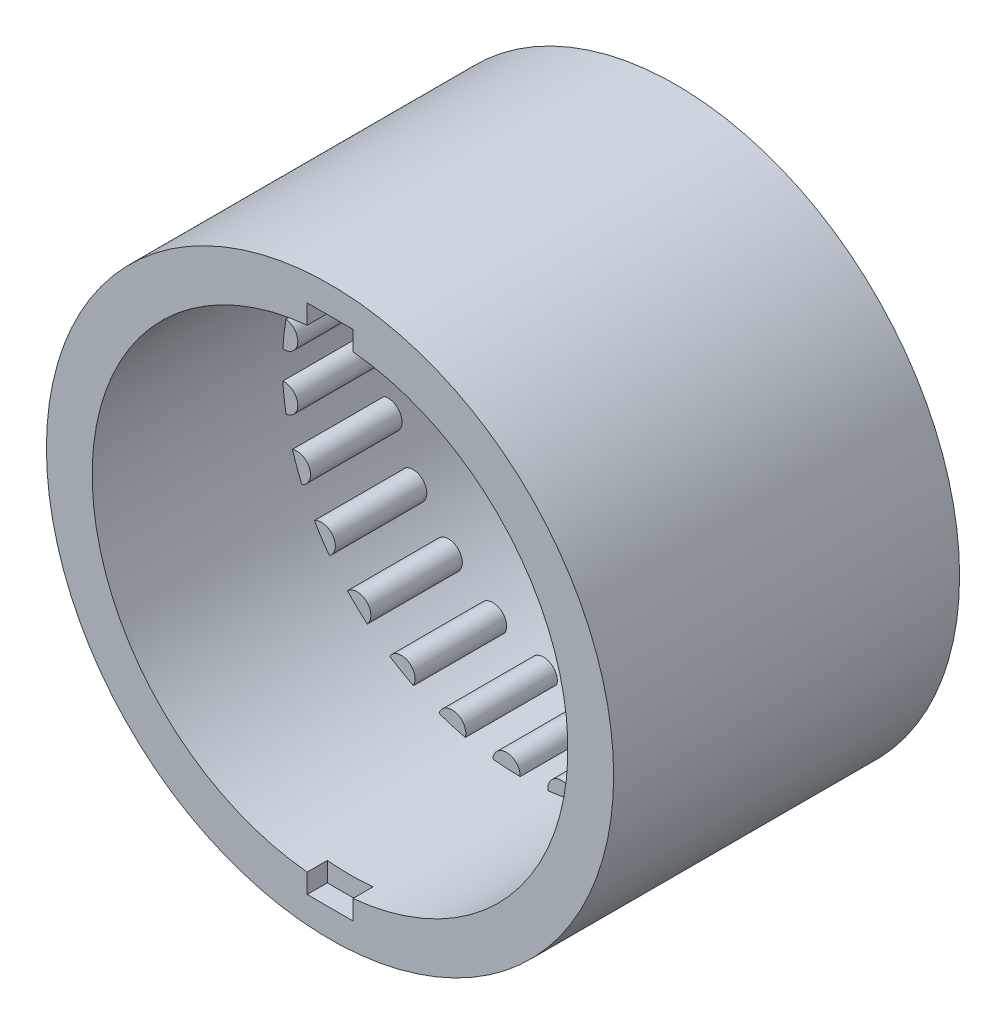
from build123d import *

# Parameters (mm, degrees)
SKETCH3_R                       = 31
SKETCH3_R_2                     = 26
BOSS_EXTRUDE1_DEPTH             = 7.0104
SKETCH4_R                       = 31
SKETCH4_R_2                     = 26
BOSS_EXTRUDE2_DEPTH             = 10
SKETCH5_R                       = 1.5
BOSS_EXTRUDE3_DEPTH             = 10
SKETCH7_R                       = 31
SKETCH7_R_2                     = 26
BOSS_EXTRUDE4_DEPTH             = 13
BOSS_EXTRUDE5_DEPTH             = 36
BOSS_EXTRUDE5_DEPTH_BACK        = 36
SKETCH9_R                       = 31
SKETCH9_R_2                     = 26.2
BOSS_EXTRUDE9_REACH             = 82.511
SKETCH34_R                      = 31
SKETCH34_R_2                    = 26
SKETCH35_R                      = 26.2
BOSS_EXTRUDE10_DEPTH            = 6
SKETCH37_R                      = 2.3
CUT_EXTRUDE1_DEPTH              = 6
SKETCH39_R                      = 11.1
CUT_EXTRUDE2_DEPTH              = 2.1
SKETCH41_R                      = 5
CUT_EXTRUDE3_DEPTH              = 4
SKETCH45_R                      = 26
CUT_EXTRUDE6_DEPTH              = 31
SKETCH47_R                      = 1.7
CUT_EXTRUDE7_DEPTH              = 118.903636822
CIRPATTERN1_COUNT               = 4
SKETCH48_W                      = 5
SKETCH48_H                      = 56
CUT_EXTRUDE10_DEPTH             = 28.4
CUT_EXTRUDE11_DEPTH             = 80.714061918
CUT_EXTRUDE12_REACH             = 106.121
CUT_EXTRUDE12_DIRECTION_2_DEPTH = 105.121407837
SKETCH54_W                      = 16.469339318
SKETCH54_H                      = 18
CUT_EXTRUDE13_DEPTH             = 105.121407837
CUT_EXTRUDE14_DEPTH             = 1.2
CUT_EXTRUDE14_DEPTH_BACK        = 74.437050306
SKETCH55_W                      = 62
SKETCH55_H                      = 72
CUT_EXTRUDE15_DEPTH             = 62.472036971


with BuildPart() as part:
    # Sketch3 → Boss-Extrude1 (new body)
    with BuildSketch(Plane.XY.offset(-2.359079422)):
        Circle(SKETCH3_R)
        Circle(SKETCH3_R_2, mode=Mode.SUBTRACT)
    extrude(amount=BOSS_EXTRUDE1_DEPTH)

    # Sketch4 → Boss-Extrude2 (add)
    with BuildSketch(Plane.XY.offset(4.651320578)):
        Circle(SKETCH4_R)
        Circle(SKETCH4_R_2, mode=Mode.SUBTRACT)
    extrude(amount=BOSS_EXTRUDE2_DEPTH)

    # Sketch5 → Boss-Extrude3 (add)
    with BuildSketch(Plane.XY.offset(4.651320578)):
        with Locations((26, 0)):
            Circle(SKETCH5_R)
        with Locations((25.299166635, -5.996012639)):
            Circle(SKETCH5_R)
        with Locations((23.234448648, -11.668778685)):
            Circle(SKETCH5_R)
        with Locations((19.917155521, -16.712477852)):
            Circle(SKETCH5_R)
        with Locations((15.526123384, -20.855203012)):
            Circle(SKETCH5_R)
        with Locations((10.298073917, -23.873618779)):
            Circle(SKETCH5_R)
        with Locations((4.514852619, -25.605001578)):
            Circle(SKETCH5_R)
        with Locations((-1.511765552, -25.956012115)):
            Circle(SKETCH5_R)
        with Locations((-7.45688405, -24.90772732)):
            Circle(SKETCH5_R)
        with Locations((-13, -22.516660498)):
            Circle(SKETCH5_R)
        with Locations((-17.842282585, -18.911714681)):
            Circle(SKETCH5_R)
        with Locations((-21.722683097, -14.28723343)):
            Circle(SKETCH5_R)
        with Locations((-24.43200814, -8.892523726)):
            Circle(SKETCH5_R)
        with Locations((-25.824197301, -3.018415767)):
            Circle(SKETCH5_R)
        with Locations((-25.824197301, 3.018415767)):
            Circle(SKETCH5_R)
        with Locations((-24.43200814, 8.892523726)):
            Circle(SKETCH5_R)
        with Locations((-21.722683097, 14.28723343)):
            Circle(SKETCH5_R)
        with Locations((-17.842282585, 18.911714681)):
            Circle(SKETCH5_R)
        with Locations((-13, 22.516660498)):
            Circle(SKETCH5_R)
        with Locations((-7.45688405, 24.90772732)):
            Circle(SKETCH5_R)
        with Locations((-1.511765552, 25.956012115)):
            Circle(SKETCH5_R)
        with Locations((4.514852619, 25.605001578)):
            Circle(SKETCH5_R)
        with Locations((10.298073917, 23.873618779)):
            Circle(SKETCH5_R)
        with Locations((15.526123384, 20.855203012)):
            Circle(SKETCH5_R)
        with Locations((19.917155521, 16.712477852)):
            Circle(SKETCH5_R)
        with Locations((23.234448648, 11.668778685)):
            Circle(SKETCH5_R)
        with Locations((25.299166635, 5.996012639)):
            Circle(SKETCH5_R)
    extrude(amount=BOSS_EXTRUDE3_DEPTH)

    # Sketch7 → Boss-Extrude4 (add)
    with BuildSketch(Plane.XY.offset(14.651320578)):
        Circle(SKETCH7_R)
        Circle(SKETCH7_R_2, mode=Mode.SUBTRACT)
    extrude(amount=BOSS_EXTRUDE4_DEPTH)


with BuildPart() as body_2:
    # Sketch9 → Boss-Extrude5 (new, two sides: drawn at the far end of the back side and taken through both)
    with BuildSketch(Plane(origin=(0, 0, 0), x_dir=(1, 0, 0), z_dir=(0, 1, 0)).offset(-BOSS_EXTRUDE5_DEPTH_BACK)):
        with Locations(Location((0, -61.651320578, 0), (0, 0, 270))):
            Circle(SKETCH9_R)
        with Locations(Location((0, -61.651320578, 0), (0, 0, 270))):
            Circle(SKETCH9_R_2, mode=Mode.SUBTRACT)
    extrude(amount=BOSS_EXTRUDE5_DEPTH + BOSS_EXTRUDE5_DEPTH_BACK)

    # Sketch34 → Boss-Extrude9 (add, up to next)
    with BuildSketch(Plane.XY.offset(27.651320578), mode=Mode.PRIVATE) as boss_extrude9_sk1:
        Circle(SKETCH34_R)
        with Locations(Location((0, 0, 0), (0, 0, 180))):
            Circle(SKETCH34_R_2, mode=Mode.SUBTRACT)
    boss_extrude9_tool1 = extrude(boss_extrude9_sk1.sketch, amount=BOSS_EXTRUDE9_REACH, mode=Mode.PRIVATE) - body_2.part

    add(part.part)  # Boss-Extrude9 merges part
    add(boss_extrude9_tool1.solids().sort_by_distance((-30.123188, 0, 27.651321))[0])

    # Sketch35 → Boss-Extrude10 (add)
    with BuildSketch(Plane.XZ.offset(36)):
        with Locations(Location((0, 61.651320578, 0), (0, 0, 90))):
            Circle(SKETCH35_R)
    extrude(amount=-BOSS_EXTRUDE10_DEPTH)

    # Sketch37 → Cut-Extrude1 (cut)
    with BuildSketch(Plane(origin=(0, -30, 0), x_dir=(1, 0, 0), z_dir=(0, 1, 0))):
        with Locations(Location((0, -77.651320578, 0), (0, 0, 270))):
            Circle(SKETCH37_R)
        with Locations(Location((-13.856406461, -69.651320578, 0), (0, 0, 270))):
            Circle(SKETCH37_R)
        with Locations(Location((-13.856406461, -53.651320578, 0), (0, 0, 270))):
            Circle(SKETCH37_R)
        with Locations(Location((0, -45.651320578, 0), (0, 0, 270))):
            Circle(SKETCH37_R)
        with Locations(Location((13.856406461, -53.651320578, 0), (0, 0, 270))):
            Circle(SKETCH37_R)
        with Locations(Location((13.856406461, -69.651320578, 0), (0, 0, 270))):
            Circle(SKETCH37_R)
    extrude(amount=-CUT_EXTRUDE1_DEPTH, mode=Mode.SUBTRACT)

    # Sketch39 → Cut-Extrude2 (cut)
    with BuildSketch(Plane(origin=(0, -30, 0), x_dir=(1, 0, 0), z_dir=(0, 1, 0))):
        with Locations(Location((0, -61.651320578, 0), (0, 0, 270))):
            Circle(SKETCH39_R)
    extrude(amount=-CUT_EXTRUDE2_DEPTH, mode=Mode.SUBTRACT)

    # Sketch41 → Cut-Extrude3 (cut)
    with BuildSketch(Plane(origin=(0, -32.1, 0), x_dir=(1, 0, 0), z_dir=(0, 1, 0))):
        with Locations(Location((0, -61.651320578, 0), (0, 0, 270))):
            Circle(SKETCH41_R)
    extrude(amount=-CUT_EXTRUDE3_DEPTH, mode=Mode.SUBTRACT)

    # Sketch45 → Cut-Extrude6 (cut)
    with BuildSketch(Plane(origin=(0, 0, 61.651320578), x_dir=(-1, 0, 0), z_dir=(0, 0, -1))):
        with Locations(Location((0, 0, 0), (0, 0, 180))):
            Circle(SKETCH45_R)
    extrude(amount=CUT_EXTRUDE6_DEPTH, mode=Mode.SUBTRACT)

    # Sketch47 → Cut-Extrude7 (cut, through all)
    with BuildSketch(Plane(origin=(0, -30, 0), x_dir=(1, 0, 0), z_dir=(0, 1, 0))):
        with Locations(Location((-15.5, -77.15132, 0), (0, 0, 270))):
            Circle(SKETCH47_R)
        with Locations(Location((-15.499999422, -46.151320578, 0), (0, 0, 270))):
            Circle(SKETCH47_R)
        with Locations(Location((15.5, -46.151321156, 0), (0, 0, 270))):
            Circle(SKETCH47_R)
        with Locations(Location((15.499999422, -77.151320578, 0), (0, 0, 270))):
            Circle(SKETCH47_R)
    extrude(amount=-CUT_EXTRUDE7_DEPTH, mode=Mode.SUBTRACT)

    # Sketch43 → Cut-Revolve1 (revolve, cut)
    with BuildSketch(Plane(origin=(-8.335079128, 0, 77.151320134), x_dir=(0.9999999999999999, 0, 1.8652727112514236e-08), z_dir=(-1.8652727112514233e-08, 0, 0.9999999999999998)), mode=Mode.PRIVATE) as cut_revolve1_sk:
        Polygon((20.835078549, -36), (22.135079128, -36), (22.135079128, -33.115), (20.835078549, -34.415), align=None)
    cut_revolve1 = revolve(cut_revolve1_sk.sketch.rotate(Axis((15.499999422, -36, 77.151320578), (0, 1, 0)), 180.000001069), axis=Axis((15.499999422, -36, 77.151320578), (0, 1, 0)), mode=Mode.SUBTRACT)

    # CirPattern1: Cut-Revolve1 ×4 about axis
    cirpattern1_axis = Axis((0, 0, 61.651320578), (0, 1, 0))
    for i in range(1, CIRPATTERN1_COUNT):
        add(cut_revolve1.rotate(cirpattern1_axis, i * 360 / CIRPATTERN1_COUNT), mode=Mode.SUBTRACT)

    # Sketch48 → Cut-Extrude10 (cut)
    with BuildSketch(Plane(origin=(0, 0, 61.651320578), x_dir=(-1, 0, 0), z_dir=(0, 0, -1))):
        Rectangle(SKETCH48_W, SKETCH48_H)
    extrude(amount=CUT_EXTRUDE10_DEPTH, mode=Mode.SUBTRACT)

    # Sketch49 → Cut-Extrude11 (cut, through all)
    with BuildSketch(Plane(origin=(0, 0, 61.651320578), x_dir=(-1, 0, 0), z_dir=(0, 0, -1))):
        with BuildLine():
            Line((-7.5, 17.5), (7.5, 17.5))
            ThreePointArc((7.5, 17.5), (9.267766953, 16.767766953), (10, 15))
            Line((10, 15), (10, -15))
            ThreePointArc((10, -15), (9.267766953, -16.767766953), (7.5, -17.5))
            Line((7.5, -17.5), (-7.5, -17.5))
            ThreePointArc((-7.5, -17.5), (-9.267766953, -16.767766953), (-10, -15))
            Line((-10, -15), (-10, 15))
            ThreePointArc((-10, 15), (-9.267766953, 16.767766953), (-7.5, 17.5))
        make_face()
    extrude(amount=-CUT_EXTRUDE11_DEPTH, mode=Mode.SUBTRACT)

    # Cut-Extrude12: up to this face of the body (flat: up to its plane)
    cut_extrude12_end = Plane(body_2.part.faces().sort_by_distance((0, -30, 36.192368485))[0])
    # Sketch51 → Cut-Extrude12 (cut, up to the picked face)
    with BuildSketch(Plane(origin=(0, 0, 0), x_dir=(1, 0, 0), z_dir=(0, 1, 0)), mode=Mode.PRIVATE) as cut_extrude12_sk1:
        with BuildLine():
            Line((-14.238968268, -82.857120578), (-16.748327145, -82.857120578))
            ThreePointArc((-16.748327145, -82.857120578), (-17.134760875, -82.78025413), (-17.462363572, -82.561357006))
            Line((-17.462363572, -82.561357006), (-20.910036428, -79.113684151))
            ThreePointArc((-20.910036428, -79.113684151), (-21.128933552, -78.786081453), (-21.2058, -78.399647723))
            Line((-21.2058, -78.399647723), (-21.2058, -75.890288846))
            Line((-21.2058, -75.890288846), (-21.2058, -47.41235231))
            Line((-21.2058, -47.41235231), (-21.2058, -44.902993434))
            ThreePointArc((-21.2058, -44.902993434), (-21.128933552, -44.516559704), (-20.910036428, -44.188957006))
            Line((-20.910036428, -44.188957006), (-17.462363572, -40.741284151))
            ThreePointArc((-17.462363572, -40.741284151), (-17.134760875, -40.522387026), (-16.748327145, -40.445520578))
            Line((-16.748327145, -40.445520578), (-14.238968268, -40.445520578))
            Line((-14.238968268, -40.445520578), (14.238968268, -40.445520578))
            Line((14.238968268, -40.445520578), (16.748327145, -40.445520578))
            ThreePointArc((16.748327145, -40.445520578), (17.134760875, -40.522387026), (17.462363572, -40.741284151))
            Line((17.462363572, -40.741284151), (20.910036428, -44.188957006))
            ThreePointArc((20.910036428, -44.188957006), (21.128933552, -44.516559704), (21.2058, -44.902993434))
            Line((21.2058, -44.902993434), (21.2058, -47.41235231))
            Line((21.2058, -47.41235231), (21.2058, -75.890288846))
            Line((21.2058, -75.890288846), (21.2058, -78.399647723))
            ThreePointArc((21.2058, -78.399647723), (21.128933552, -78.786081453), (20.910036428, -79.113684151))
            Line((20.910036428, -79.113684151), (17.462363572, -82.561357006))
            ThreePointArc((17.462363572, -82.561357006), (17.134760875, -82.78025413), (16.748327145, -82.857120578))
            Line((16.748327145, -82.857120578), (14.238968268, -82.857120578))
            Line((14.238968268, -82.857120578), (-14.238968268, -82.857120578))
        make_face()
    cut_extrude12_tool1 = split(extrude(cut_extrude12_sk1.sketch, amount=-CUT_EXTRUDE12_REACH, mode=Mode.PRIVATE), bisect_by=cut_extrude12_end, keep=Keep.BOTH, mode=Mode.PRIVATE)
    add(cut_extrude12_tool1.solids().sort_by(Axis((0, 0, 61.651321), (0, -1, 0)))[0], mode=Mode.SUBTRACT)

    # Sketch51 → Cut-Extrude12 direction 2 (cut)
    with BuildSketch(Plane(origin=(0, 0, 0), x_dir=(1, 0, 0), z_dir=(0, 1, 0))):
        with BuildLine():
            Line((-14.238968268, -82.857120578), (-16.748327145, -82.857120578))
            ThreePointArc((-16.748327145, -82.857120578), (-17.134760875, -82.78025413), (-17.462363572, -82.561357006))
            Line((-17.462363572, -82.561357006), (-20.910036428, -79.113684151))
            ThreePointArc((-20.910036428, -79.113684151), (-21.128933552, -78.786081453), (-21.2058, -78.399647723))
            Line((-21.2058, -78.399647723), (-21.2058, -75.890288846))
            Line((-21.2058, -75.890288846), (-21.2058, -47.41235231))
            Line((-21.2058, -47.41235231), (-21.2058, -44.902993434))
            ThreePointArc((-21.2058, -44.902993434), (-21.128933552, -44.516559704), (-20.910036428, -44.188957006))
            Line((-20.910036428, -44.188957006), (-17.462363572, -40.741284151))
            ThreePointArc((-17.462363572, -40.741284151), (-17.134760875, -40.522387026), (-16.748327145, -40.445520578))
            Line((-16.748327145, -40.445520578), (-14.238968268, -40.445520578))
            Line((-14.238968268, -40.445520578), (14.238968268, -40.445520578))
            Line((14.238968268, -40.445520578), (16.748327145, -40.445520578))
            ThreePointArc((16.748327145, -40.445520578), (17.134760875, -40.522387026), (17.462363572, -40.741284151))
            Line((17.462363572, -40.741284151), (20.910036428, -44.188957006))
            ThreePointArc((20.910036428, -44.188957006), (21.128933552, -44.516559704), (21.2058, -44.902993434))
            Line((21.2058, -44.902993434), (21.2058, -47.41235231))
            Line((21.2058, -47.41235231), (21.2058, -75.890288846))
            Line((21.2058, -75.890288846), (21.2058, -78.399647723))
            ThreePointArc((21.2058, -78.399647723), (21.128933552, -78.786081453), (20.910036428, -79.113684151))
            Line((20.910036428, -79.113684151), (17.462363572, -82.561357006))
            ThreePointArc((17.462363572, -82.561357006), (17.134760875, -82.78025413), (16.748327145, -82.857120578))
            Line((16.748327145, -82.857120578), (14.238968268, -82.857120578))
            Line((14.238968268, -82.857120578), (-14.238968268, -82.857120578))
        make_face()
    extrude(amount=CUT_EXTRUDE12_DIRECTION_2_DEPTH, mode=Mode.SUBTRACT)

    # Sketch54 → Cut-Extrude13 (cut, through all)
    with BuildSketch(Plane(origin=(0, 0, 0), x_dir=(0, 0, -1), z_dir=(1, 0, 0))):
        with Locations((-61.651320578, 27)):
            Rectangle(SKETCH54_W, SKETCH54_H)
    extrude(amount=-CUT_EXTRUDE13_DEPTH, mode=Mode.SUBTRACT)

    # Sketch55 → Cut-Extrude14 (cut, two sides: drawn at the far end of the back side and taken through both)
    with BuildSketch(Plane(origin=(0, 0, 36.651320578), x_dir=(-1, 0, 0), z_dir=(0, 0, -1)).offset(-CUT_EXTRUDE14_DEPTH_BACK)):
        Rectangle(SKETCH55_W, SKETCH55_H)
    extrude(amount=CUT_EXTRUDE14_DEPTH + CUT_EXTRUDE14_DEPTH_BACK, mode=Mode.SUBTRACT)

    # Sketch56 → Cut-Extrude15 (cut, through all)
    with BuildSketch(Plane(origin=(0, 0, 36.651320578), x_dir=(-1, 0, 0), z_dir=(0, 0, -1))):
        with BuildLine():
            Line((-16.569852142, 36), (-16.569852142, 26.2))
            ThreePointArc((-16.569852142, 26.2), (0, 31), (16.569852142, 26.2))
            Line((16.569852142, 26.2), (16.569852142, 36))
            Line((16.569852142, 36), (-16.569852142, 36))
        make_face()
        with BuildLine():
            Line((16.569852142, -36), (16.569852142, -26.2))
            ThreePointArc((16.569852142, -26.2), (0, -31), (-16.569852142, -26.2))
            Line((-16.569852142, -26.2), (-16.569852142, -36))
            Line((-16.569852142, -36), (16.569852142, -36))
        make_face()
    extrude(amount=CUT_EXTRUDE15_DEPTH, mode=Mode.SUBTRACT)


solid = body_2.part
